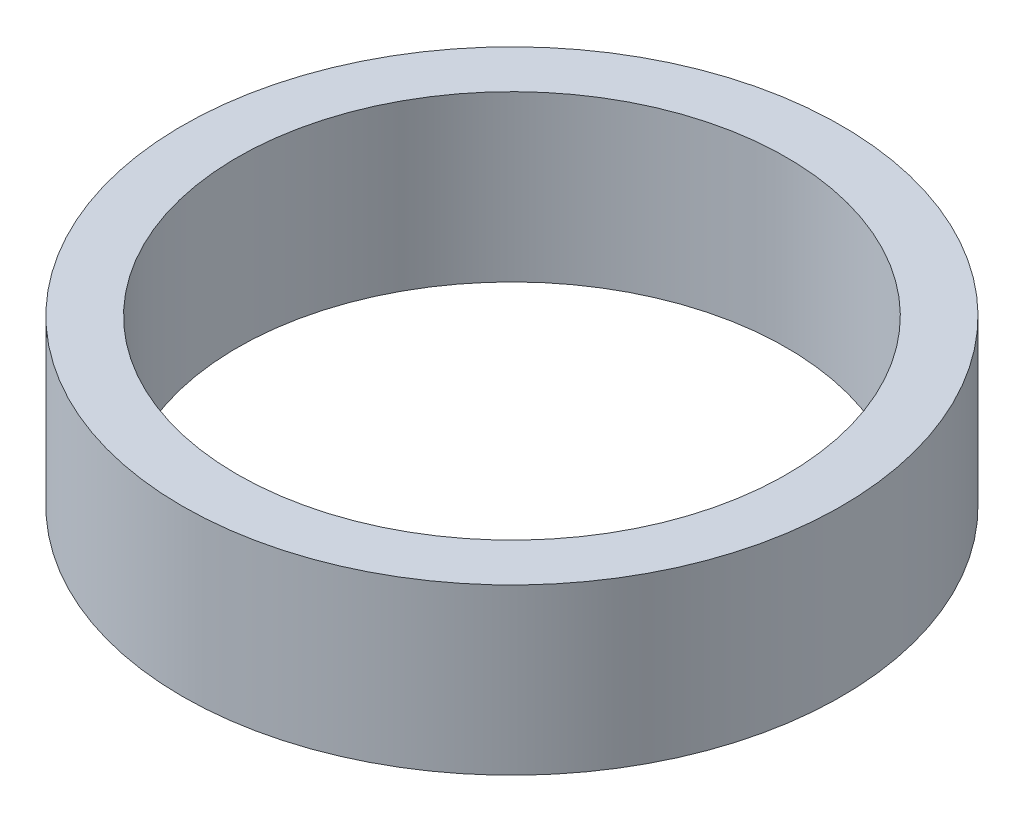
from build123d import *

# Parameters (mm, degrees)
SKETCH1_R           = 6
BOSS_EXTRUDE2_DEPTH = 3
SKETCH3_R           = 5
CUT_EXTRUDE1_DEPTH  = 20


with BuildPart() as part:
    # Sketch1 → Boss-Extrude2 (new body)
    with BuildSketch(Plane(origin=(0, 0, 0), x_dir=(1, 0, 0), z_dir=(0, 1, 0))):
        with Locations(Location((0, 0, 0), (0, 0, 270))):
            Circle(SKETCH1_R)
    extrude(amount=BOSS_EXTRUDE2_DEPTH)

    # Sketch3 → Cut-Extrude1 (cut)
    with BuildSketch(Plane(origin=(0, 3, 0), x_dir=(1, 0, 0), z_dir=(0, 1, 0))):
        with Locations(Location((0, 0, 0), (0, 0, 270))):
            Circle(SKETCH3_R)
    extrude(amount=-CUT_EXTRUDE1_DEPTH, mode=Mode.SUBTRACT)


solid = part.part
